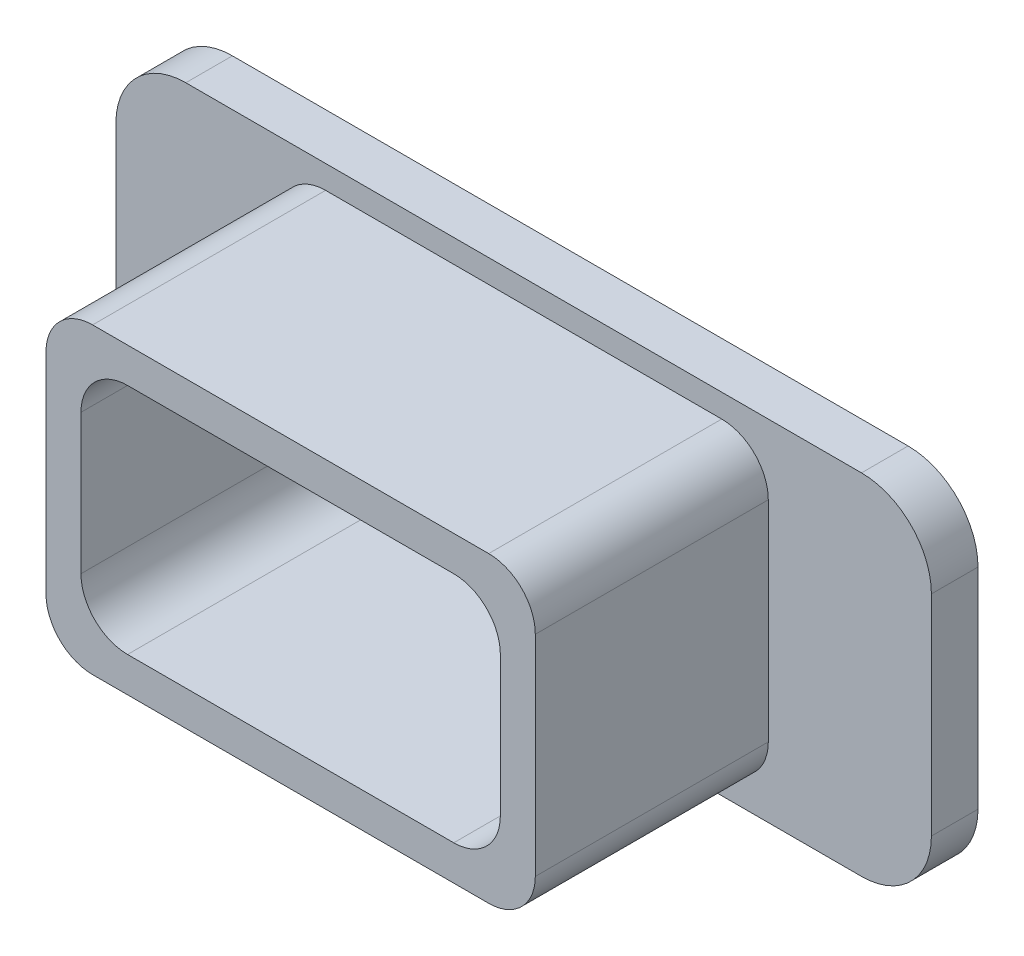
from build123d import *

# Parameters (mm, degrees)
SKETCH_1_W      = 35
SKETCH_1_H      = 15
SKETCH_1_W_2    = 18
SKETCH_1_H_2    = 10
EXTRUDE_1_DEPTH = 2
SKETCH_2_W      = 21
SKETCH_2_H      = 13
SKETCH_2_W_2    = 18
SKETCH_2_H_2    = 10
EXTRUDE_2_DEPTH = 10
FILLET_1_R      = 3
FILLET_2_R      = 2
FILLET_3_R      = 2


with BuildPart() as part:
    # 草图1 → 凸台-拉伸1 (new body)
    with BuildSketch(Plane.XY):
        Rectangle(SKETCH_1_W, SKETCH_1_H)
        Rectangle(SKETCH_1_W_2, SKETCH_1_H_2, mode=Mode.SUBTRACT)
    extrude(amount=EXTRUDE_1_DEPTH)

    # 草图2 → 凸台-拉伸2 (add)
    with BuildSketch(Plane.XY.offset(2)):
        Rectangle(SKETCH_2_W, SKETCH_2_H)
        Rectangle(SKETCH_2_W_2, SKETCH_2_H_2, mode=Mode.SUBTRACT)
    extrude(amount=EXTRUDE_2_DEPTH)

    # 圆角1
    fillet_1_edges = [part.edges().sort_by_distance(p)[0] for p in [
        (17.5, -7.5, 1),
        (-17.5, -7.5, 1),
        (-17.5, 7.5, 1),
        (17.5, 7.5, 1),
    ]]
    fillet(fillet_1_edges, radius=FILLET_1_R)

    # 圆角2
    fillet_2_edges = [part.edges().sort_by_distance(p)[0] for p in [
        (9, -5, 6),
        (9, 5, 6),
        (-9, 5, 6),
        (-9, -5, 6),
    ]]
    fillet(fillet_2_edges, radius=FILLET_2_R)

    # 圆角3
    fillet_3_edges = [part.edges().sort_by_distance(p)[0] for p in [
        (10.5, -6.5, 7),
        (10.5, 6.5, 7),
        (-10.5, 6.5, 7),
        (-10.5, -6.5, 7),
    ]]
    fillet(fillet_3_edges, radius=FILLET_3_R)


solid = part.part
